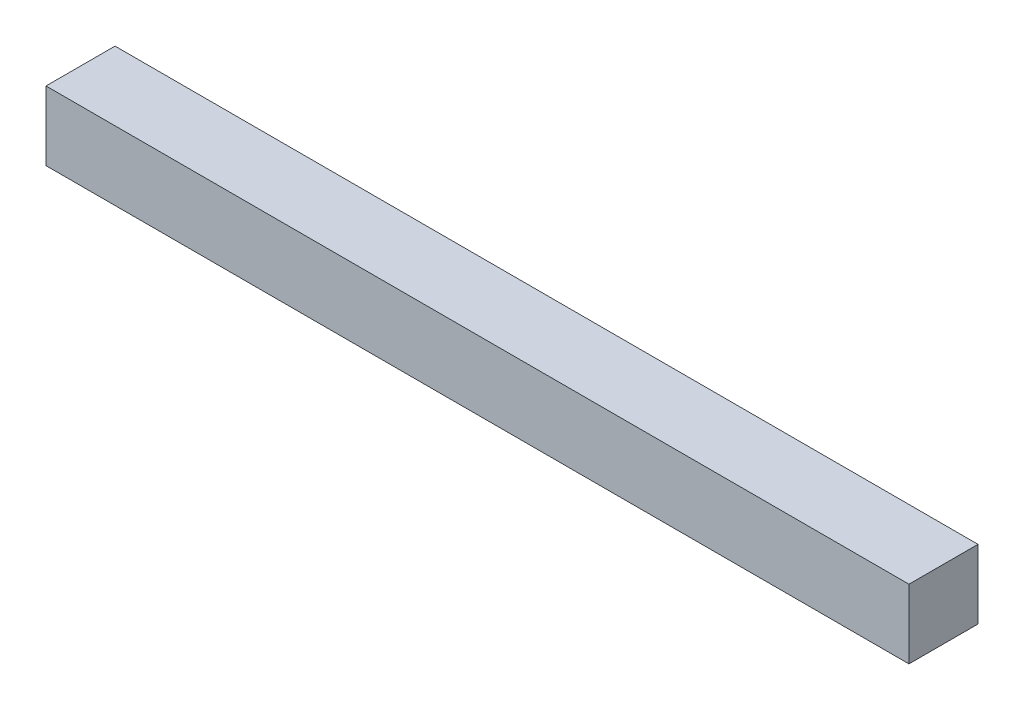
from build123d import *

# Parameters (mm, degrees)
SKETCH1_W           = 200
SKETCH1_H           = 16
BOSS_EXTRUDE1_DEPTH = 16


with BuildPart() as part:
    # Sketch1 → Boss-Extrude1 (new body)
    with BuildSketch(Plane.XY):
        with Locations((100, 8)):
            Rectangle(SKETCH1_W, SKETCH1_H)
    extrude(amount=BOSS_EXTRUDE1_DEPTH)


solid = part.part
